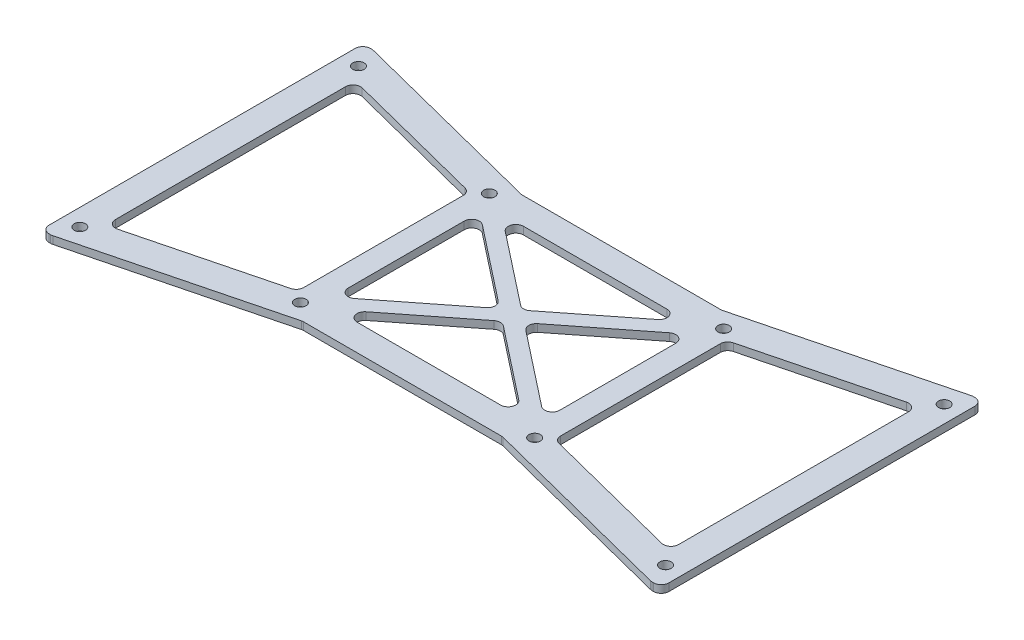
from build123d import *

# Parameters (mm, degrees)
SKETCH_1_W          = 164
SKETCH_1_H          = 85
EXTRUDE_1_DEPTH     = 2
SKETCH_2_R          = 1.5
CUT_EXTRUDE_1_DEPTH = 2
SKETCH_4_W          = 56
SKETCH_4_H          = 44
CUT_EXTRUDE_3_DEPTH = 10
EXTRUDE_2_DEPTH     = 2
SKETCH_9_R          = 1.5
CUT_EXTRUDE_6_DEPTH = 10
CUT_EXTRUDE_7_DEPTH = 10
CUT_EXTRUDE_8_DEPTH = 10
FILLET_3_R          = 2
FILLET_4_R          = 2


with BuildPart() as part:
    # 草图1 → 凸台-拉伸1 (new body)
    with BuildSketch(Plane(origin=(0, 0, 0), x_dir=(1, 0, 0), z_dir=(0, 1, 0))):
        Rectangle(SKETCH_1_W, SKETCH_1_H)
    extrude(amount=EXTRUDE_1_DEPTH)

    # 草图2 → 切除-拉伸1 (cut)
    with BuildSketch(Plane(origin=(0, 2, 0), x_dir=(1, 0, 0), z_dir=(0, 1, 0))):
        with Locations(Location((31, 25, 0), (0, 0, 270))):
            Circle(SKETCH_2_R)
        with Locations(Location((-31, 25, 0), (0, 0, 270))):
            Circle(SKETCH_2_R)
        with Locations(Location((-31, -25, 0), (0, 0, 270))):
            Circle(SKETCH_2_R)
        with Locations(Location((31, -25, 0), (0, 0, 270))):
            Circle(SKETCH_2_R)
    extrude(amount=-CUT_EXTRUDE_1_DEPTH, mode=Mode.SUBTRACT)

    # 草图4 → 切除-拉伸3 (cut)
    with BuildSketch(Plane(origin=(0, 2, 0), x_dir=(1, 0, 0), z_dir=(0, 1, 0))):
        Rectangle(SKETCH_4_W, SKETCH_4_H)
    extrude(amount=-CUT_EXTRUDE_3_DEPTH, mode=Mode.SUBTRACT)

    # 草图7 → 凸台-拉伸2 (add)
    with BuildSketch(Plane(origin=(0, 2, 0), x_dir=(1, 0, 0), z_dir=(0, 1, 0))):
        Polygon((0, -2.543499116), (-3.237180694, 0), (-28, -19.456500884), (-28, -22), (-24.762819306, -22), align=None)
        Polygon((0, 2.543499116), (-3.237180694, 0), (0, -2.543499116), (3.237180694, 0), align=None)
        Polygon((24.762819306, 22), (0, 2.543499116), (3.237180694, 0), (28, 19.456500884), (28, 22), align=None)
        Polygon((3.237180694, 0), (0, -2.543499116), (24.762819306, -22), (28, -22), (28, -19.456500884), align=None)
        Polygon((-28, 22), (-28, 19.456500884), (-3.237180694, 0), (0, 2.543499116), (-24.762819306, 22), align=None)
    extrude(amount=-EXTRUDE_2_DEPTH)

    # 草图9 → 切除-拉伸6 (cut)
    with BuildSketch(Plane(origin=(0, 2, 0), x_dir=(1, 0, 0), z_dir=(0, 1, 0))):
        with Locations(Location((77.5, -36.869534675, 0), (0, 0, 270))):
            Circle(SKETCH_9_R)
        with Locations(Location((77.5, 36.869534675, 0), (0, 0, 270))):
            Circle(SKETCH_9_R)
    cut_extrude_6 = extrude(amount=-CUT_EXTRUDE_6_DEPTH, mode=Mode.SUBTRACT)

    # 镜向3: 切除-拉伸6 across plane
    add(cut_extrude_6.mirror(Plane(origin=(0, 0, 0), x_dir=(0, 0, 1), z_dir=(1, 0, 0))), mode=Mode.SUBTRACT)

    # 草图11 → 切除-拉伸7 (cut)
    with BuildSketch(Plane.XZ):
        Polygon((-74.5, 33.007564849), (-34, 22.669583035), (-34, -22.669583035), (-74.5, -33.007564849), align=None)
    cut_extrude_7 = extrude(amount=-CUT_EXTRUDE_7_DEPTH, mode=Mode.SUBTRACT)

    # 镜向4: 切除-拉伸7 across plane
    add(cut_extrude_7.mirror(Plane(origin=(0, 0, 0), x_dir=(0, 0, 1), z_dir=(1, 0, 0))), mode=Mode.SUBTRACT)

    # 草图12 → 切除-拉伸8 (cut)
    with BuildSketch(Plane.XZ):
        Polygon((-79.341828688, 42.5), (-26.454329961, 29), (26.454329961, 29), (79.341828688, 42.5), align=None)
    cut_extrude_8 = extrude(amount=-CUT_EXTRUDE_8_DEPTH, mode=Mode.SUBTRACT)

    # 镜向5: 切除-拉伸8 across plane
    add(cut_extrude_8.mirror(Plane.XY), mode=Mode.SUBTRACT)

    # 圆角3
    fillet_3_edges = [part.edges().sort_by_distance(p)[0] for p in [
        (-74.5, 1, -33.007564849),
        (-74.5, 1, 33.007564849),
        (-34, 1, 22.669583035),
        (-34, 1, -22.669583035),
        (74.5, 1, 33.007564849),
        (74.5, 1, -33.007564849),
        (34, 1, -22.669583035),
        (34, 1, 22.669583035),
        (-28, 1, 19.456500884),
        (-3.237180694, 1, 0),
        (-28, 1, -19.456500884),
        (-24.762819306, 1, -22),
        (0, 1, -2.543499116),
        (24.762819306, 1, -22),
        (28, 1, -19.456500884),
        (3.237180694, 1, 0),
        (28, 1, 19.456500884),
        (24.762819306, 1, 22),
        (0, 1, 2.543499116),
        (-24.762819306, 1, 22),
    ]]
    fillet(fillet_3_edges, radius=FILLET_3_R)

    # 圆角4
    fillet_4_edges = [part.edges().sort_by_distance(p)[0] for p in [
        (-79.341828688, 1, 42.5),
        (79.341828688, 1, 42.5),
        (26.454329961, 1, 29),
        (-26.454329961, 1, 29),
        (79.341828688, 1, -42.5),
        (-79.341828688, 1, -42.5),
        (-26.454329961, 1, -29),
        (26.454329961, 1, -29),
        (82, 1, 42.5),
        (-82, 1, 42.5),
        (-82, 1, -42.5),
        (82, 1, -42.5),
    ]]
    fillet(fillet_4_edges, radius=FILLET_4_R)


solid = part.part
